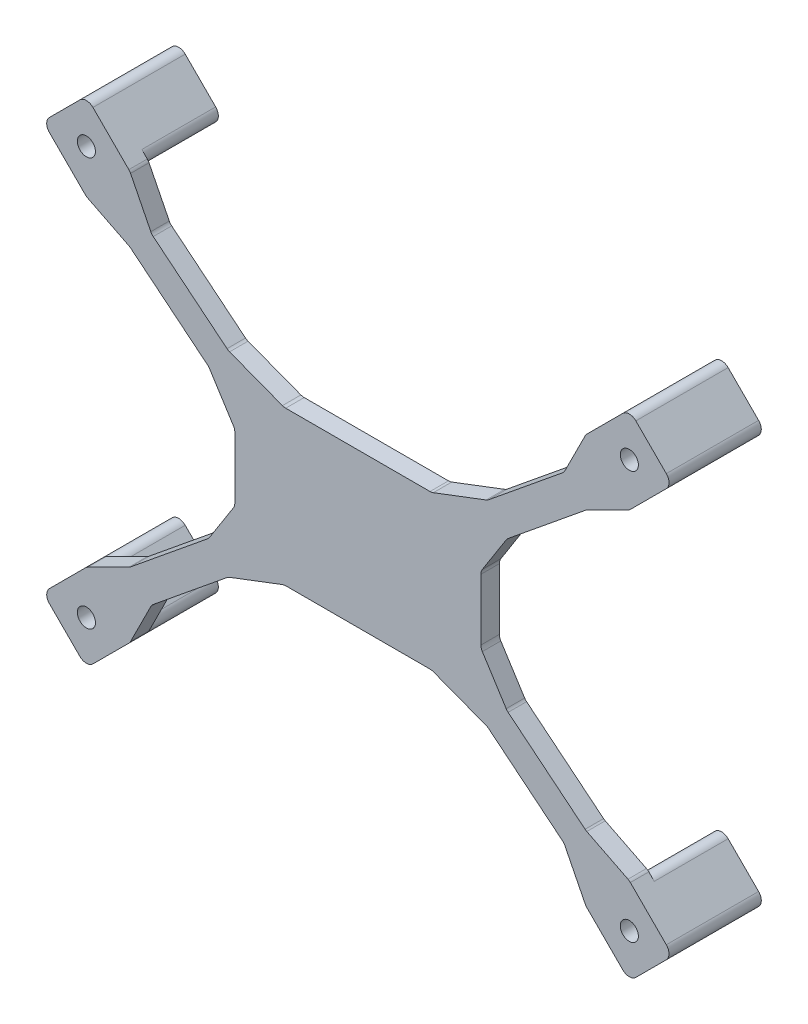
from build123d import *

# Parameters (mm, degrees)
BOSS_EXTRUDE1_DEPTH   = 15
BOSS_EXTRUDE1_2_DEPTH = 15
BOSS_EXTRUDE1_3_DEPTH = 15
BOSS_EXTRUDE1_4_DEPTH = 15
BOSS_EXTRUDE2_DEPTH   = 3
F_2_CLEARANCE_HOLE1_D = 2.9464
FILLET2_R             = 1.5
FILLET3_R             = 1.5


with BuildPart() as part:
    # Sketch1 → Boss-Extrude1 (new body)
    with BuildSketch(Plane.XY):
        Polygon((-51.196067812, 33.16), (-44.125, 40.231067812), (-37.053932188, 33.16), (-44.125, 26.088932188), align=None)
    extrude(amount=BOSS_EXTRUDE1_DEPTH)



with BuildPart() as body_2:
    # Sketch1 → Boss-Extrude1 2 (new body)
    with BuildSketch(Plane.XY):
        Polygon((44.125, 26.088932188), (37.053932188, 33.16), (44.125, 40.231067812), (51.196067812, 33.16), align=None)
    extrude(amount=BOSS_EXTRUDE1_2_DEPTH)


with BuildPart() as body_3:
    # Sketch1 → Boss-Extrude1 3 (new body)
    with BuildSketch(Plane.XY):
        Polygon((37.053932188, -33.16), (44.125, -26.088932188), (51.196067812, -33.16), (44.125, -40.231067812), align=None)
    extrude(amount=BOSS_EXTRUDE1_3_DEPTH)


with BuildPart() as body_4:
    # Sketch1 → Boss-Extrude1 4 (new body)
    with BuildSketch(Plane.XY):
        Polygon((-44.125, -40.231067812), (-51.196067812, -33.16), (-44.125, -26.088932188), (-37.053932188, -33.16), align=None)
    extrude(amount=BOSS_EXTRUDE1_4_DEPTH)


with BuildPart() as part_1:
    add(part.part)

    add(body_2.part)  # Boss-Extrude2 merges body 2

    add(body_3.part)  # Boss-Extrude2 merges body 3

    add(body_4.part)  # Boss-Extrude2 merges body 4
    # Sketch2 → Boss-Extrude2 (add)
    with BuildSketch(Plane.XY.offset(15)):
        Polygon((-16.839511506, 12.5), (16.839511506, 12.5), (33.509317925, 26.098012545), (37.053932188, 33.16), (44.125, 26.088932188), (37.063012545, 22.544317925), (20, 8.625556495), (20, -8.625556495), (37.063012545, -22.544317925), (44.125, -26.088932188), (37.053932188, -33.16), (33.509317925, -26.098012545), (16.839511506, -12.5), (-16.839511506, -12.5), (-33.509317925, -26.098012545), (-37.053932188, -33.16), (-44.125, -26.088932188), (-37.063012545, -22.544317925), (-20, -8.625556495), (-20, 8.625556495), align=None)
        Polygon((-13.695257257, 13.144844299), (-21.07904964, 15.95830607), (-16.839511506, 12.5), (-12.002895034, 12.5), align=None)
        Polygon((-16.839511506, 12.5), (-20, 8.625556495), (-37.063012545, 22.544317925), (-44.125, 26.088932188), (-37.053932188, 33.16), (-33.509317925, 26.098012545), align=None)
        Polygon((-20, 8.625556495), (-24.239538134, 12.083862565), (-20, 5.415858854), align=None)
        Polygon((-20, -8.625556495), (-20, -5.415858854), (-24.239538134, -12.083862565), align=None)
        Polygon((-16.839511506, -12.5), (-21.07904964, -15.95830607), (-13.695257257, -13.144844299), (-12.002895034, -12.5), align=None)
        Polygon((16.839511506, -12.5), (12.002895034, -12.5), (13.695257257, -13.144844299), (21.07904964, -15.95830607), align=None)
        Polygon((24.239538134, -12.083862565), (20, -5.415858854), (20, -8.625556495), align=None)
        Polygon((20, 5.415858854), (24.239538134, 12.083862565), (20, 8.625556495), align=None)
        Polygon((13.695257257, 13.144844299), (12.002895034, 12.5), (16.839511506, 12.5), (21.07904964, 15.95830607), align=None)
    extrude(amount=-BOSS_EXTRUDE2_DEPTH)

    # #2 Clearance Hole1 (through all)
    with Locations(Plane(origin=(0, 0, 0), x_dir=(-1, 0, 0), z_dir=(0, 0, -1))):
        with Locations((-44.125, 33.16), (44.125, 33.16), (44.125, -33.16), (-44.125, -33.16)):
            Hole(F_2_CLEARANCE_HOLE1_D / 2)

    # Fillet2
    fillet2_edges = [part_1.edges().sort_by_distance(p)[0] for p in [
        (37.053932188, 33.16, 6),
        (44.125, 26.088932188, 6),
        (51.196067812, 33.16, 7.5),
        (44.125, 40.231067812, 7.5),
        (44.125, -26.088932188, 6),
        (37.053932188, -33.16, 6),
        (44.125, -40.231067812, 7.5),
        (51.196067812, -33.16, 7.5),
        (-44.125, -40.231067812, 7.5),
        (-37.053932188, -33.16, 6),
        (-44.125, -26.088932188, 6),
        (-51.196067812, -33.16, 7.5),
        (-37.053932188, 33.16, 6),
        (-44.125, 26.088932188, 6),
        (-51.196067812, 33.16, 7.5),
        (-44.125, 40.231067812, 7.5),
    ]]
    fillet(fillet2_edges, radius=FILLET2_R)

    # Fillet3
    fillet3_edges = [part_1.edges().sort_by_distance(p)[0] for p in [
        (20, 5.415858854, 13.5),
        (20, -5.415858854, 13.5),
        (24.239538134, -12.083862565, 13.5),
        (37.063012545, -22.544317925, 13.5),
        (44.125, -26.088932188, 13.5),
        (37.053932188, -33.16, 13.5),
        (33.509317925, -26.098012545, 13.5),
        (21.07904964, -15.95830607, 13.5),
        (12.002895034, -12.5, 13.5),
        (-12.002895034, -12.5, 13.5),
        (-21.07904964, -15.95830607, 13.5),
        (-33.509317925, -26.098012545, 13.5),
        (-37.053932188, -33.16, 13.5),
        (-44.125, -26.088932188, 13.5),
        (-37.063012545, -22.544317925, 13.5),
        (-24.239538134, -12.083862565, 13.5),
        (-20, -5.415858854, 13.5),
        (-20, 5.415858854, 13.5),
        (-24.239538134, 12.083862565, 13.5),
        (-37.063012545, 22.544317925, 13.5),
        (-33.509317925, 26.098012545, 13.5),
        (-21.07904964, 15.95830607, 13.5),
        (-12.002895034, 12.5, 13.5),
        (12.002895034, 12.5, 13.5),
        (21.07904964, 15.95830607, 13.5),
        (33.509317925, 26.098012545, 13.5),
        (37.053932188, 33.16, 13.5),
        (44.125, 26.088932188, 13.5),
        (37.063012545, 22.544317925, 13.5),
        (24.239538134, 12.083862565, 13.5),
        (-37.053932188, 33.16, 13.5),
        (-44.125, 26.088932188, 13.5),
    ]]
    fillet(fillet3_edges, radius=FILLET3_R)


solid = part_1.part
